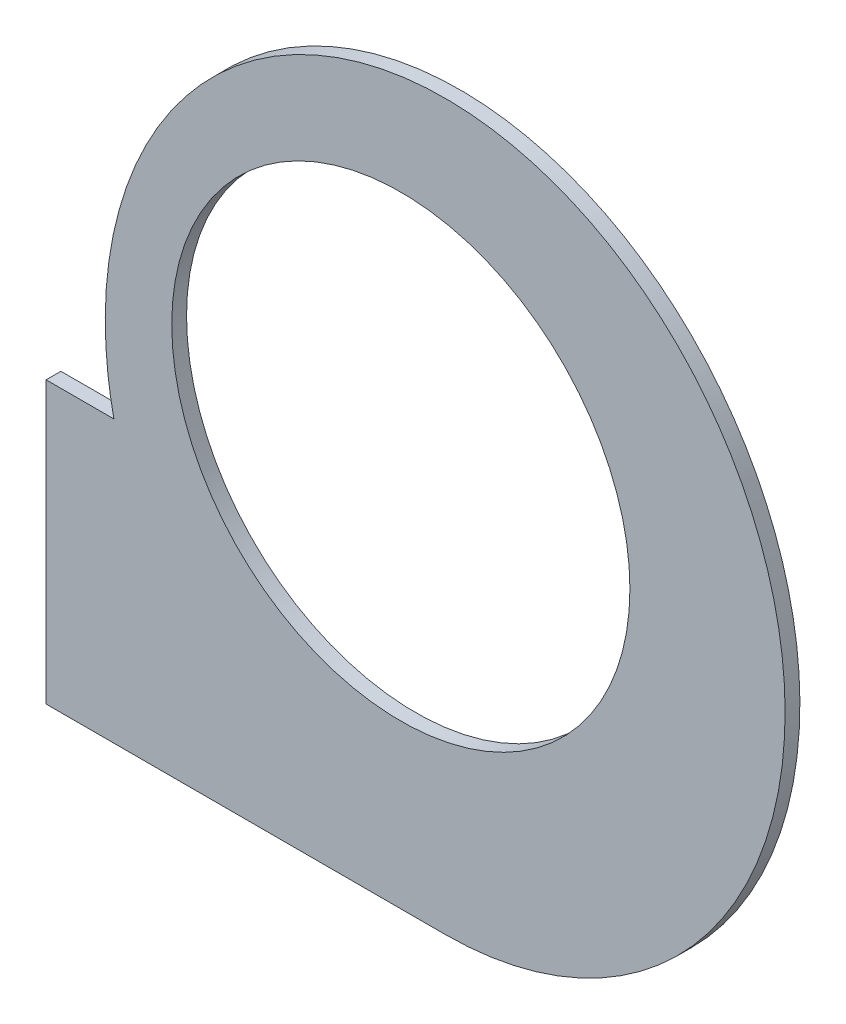
from build123d import *

# Parameters (mm, degrees)
ESBO_O1_R                = 15.5
RESSALTO_EXTRUS_O1_DEPTH = 1


with BuildPart() as part:
    # Esboço1 → Ressalto-extrusão1 (new body)
    with BuildSketch(Plane.XY):
        with BuildLine():
            Line((0, -24.5), (-27, -24.5))
            Line((-27, -24.5), (-27, -5.5))
            Line((-27, -5.5), (-22.412958113, -5.5))
            add(Edge.make_bspline(
                [(0, -24.5), (65.836852825, -24.5), (14.322096529, 19.170289513), (-37.192659768, 62.840579025), (-22.412958113, -5.5)],
                knots=[3.141592654, 3.141592654, 3.141592654, 5.610996862, 5.610996862, 8.080401071, 8.080401071, 8.080401071], degree=2, weights=[1, 0.329802368, 1, 0.329802368, 1]))
        make_face()
        with Locations((-3, 2)):
            Circle(ESBO_O1_R, mode=Mode.SUBTRACT)
    extrude(amount=RESSALTO_EXTRUS_O1_DEPTH)


solid = part.part
